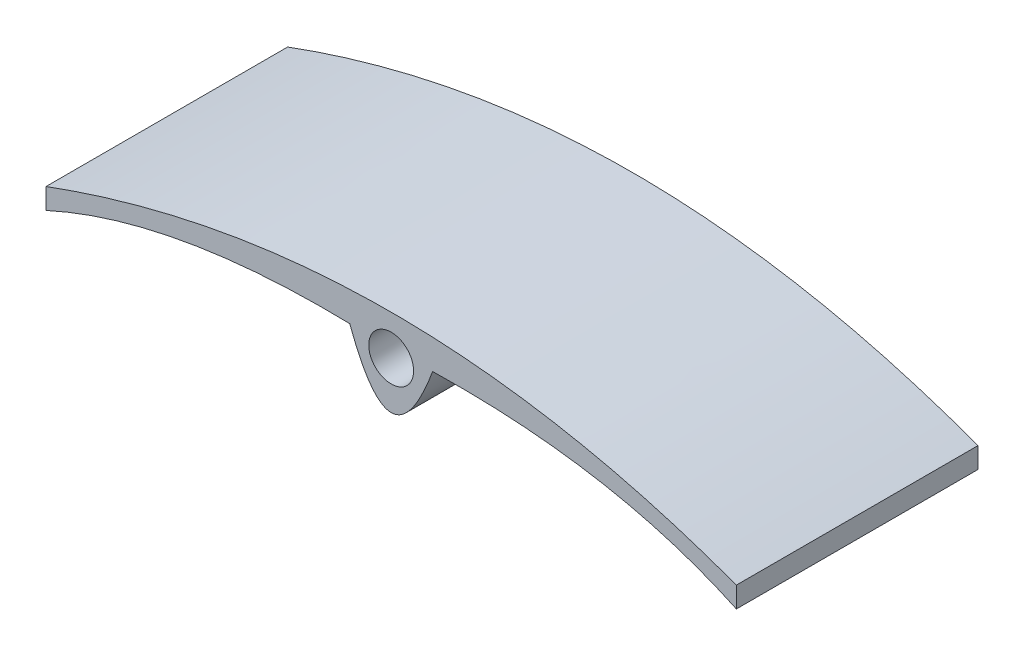
from build123d import *

# Parameters (mm, degrees)
SKETCH_1_R      = 3.25
EXTRUDE_1_DEPTH = 35


with BuildPart() as part:
    # 草圖1 → 填料-伸長1 (new body)
    with BuildSketch(Plane.XY):
        with BuildLine():
            Line((-50, -3.480646824), (-50, -6.480646824))
            add(Edge.make_bspline(
                [(-6, 1.314323068), (-31.607950909, 1.920554197), (-50, -6.480646824)],
                knots=[0, 0, 0, 1, 1, 1], degree=2))
            add(Edge.make_bspline(
                [(-6, 1.314323068), (0, -15), (6, 1.314323068)],
                knots=[0, 0, 0, 1, 1, 1], degree=2))
            add(Edge.make_bspline(
                [(6, 1.314323068), (32.228671013, 1.920554197), (50, -6.480646824)],
                knots=[0, 0, 0, 1, 1, 1], degree=2))
            Line((50, -6.480646824), (50, -3.480646824))
            add(Edge.make_bspline(
                [(-50, -3.480646824), (0, 15), (50, -3.480646824)],
                knots=[0, 0, 0, 1, 1, 1], degree=2))
        make_face()
        Circle(SKETCH_1_R, mode=Mode.SUBTRACT)
    extrude(amount=EXTRUDE_1_DEPTH)


solid = part.part
